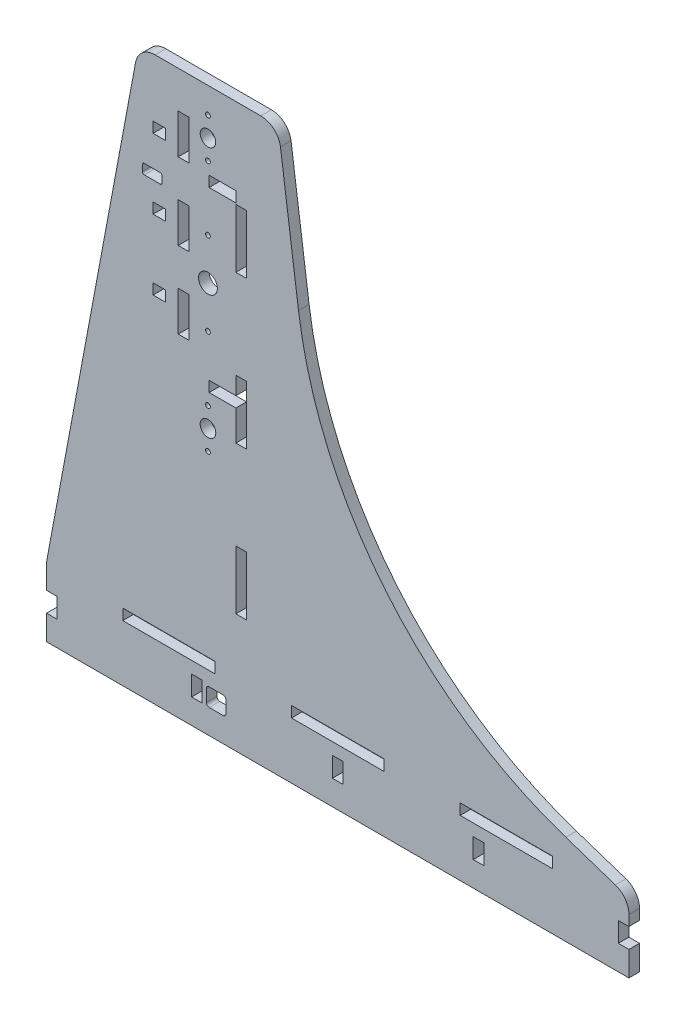
from build123d import *

# Parameters (mm, degrees)
MODEL_R             = 3.915
MODEL_R_2           = 1.2
MODEL_R_3           = 4.75
MODEL_R_4           = 3.95
MODEL_W             = 46.666
MODEL_H             = 5.5
MODEL_W_2           = 5.35
MODEL_H_2           = 10
MODEL_W_3           = 6.35
MODEL_H_3           = 5.35
MODEL_H_4           = 20
MODEL_H_5           = 29.666
MODEL_W_4           = 13.5
BOSS_EXTRUDE1_DEPTH = 5.35


with BuildPart() as part:
    # Model → Boss-Extrude1 (new body)
    with BuildSketch(Plane.XY):
        with BuildLine():
            Line((-147, 22.5), (-147, 33.91))
            ThreePointArc((-147, 33.91), (-146.957472748, 34.831268946), (-146.830252706, 35.744702086))
            Line((-146.830252706, 35.744702086), (-102.020252706, 275.834702086))
            ThreePointArc((-102.020252706, 275.834702086), (-98.579560984, 281.692432023), (-92.19, 284))
            Line((-92.19, 284), (-38.8, 284))
            ThreePointArc((-38.8, 284), (-32.222459634, 281.532327843), (-28.891161913, 275.347192548))
            Line((-28.891161913, 275.347192548), (-19.790761745, 208.412149045))
            ThreePointArc((-19.790761745, 208.412149045), (24.403039643, 107.726661994), (115.140729145, 45.619246274))
            Line((115.140729145, 45.619246274), (140.162263543, 37.27877618))
            ThreePointArc((140.162263543, 37.27877618), (145.112417501, 33.639047376), (147, 27.791938494))
            Line((147, 27.791938494), (147, 22.5))
            Line((147, 22.5), (141.65, 22.5))
            Line((141.65, 22.5), (141.65, 12.5))
            Line((141.65, 12.5), (147, 12.5))
            Line((147, 12.5), (147, 0))
            Line((147, 0), (-147, 0))
            Line((-147, 0), (-147, 12.5))
            Line((-147, 12.5), (-141.65, 12.5))
            Line((-141.65, 12.5), (-141.65, 22.5))
            Line((-141.65, 22.5), (-147, 22.5))
        make_face()
        with Locations((-65.5, 261)):
            Circle(MODEL_R, mode=Mode.SUBTRACT)
        with Locations((-65.5, 271)):
            Circle(MODEL_R_2, mode=Mode.SUBTRACT)
        with Locations((-65.5, 251)):
            Circle(MODEL_R_2, mode=Mode.SUBTRACT)
        with Locations((-65.5, 197.5)):
            Circle(MODEL_R_3, mode=Mode.SUBTRACT)
        with Locations((-65.5, 218.5)):
            Circle(MODEL_R_2, mode=Mode.SUBTRACT)
        with Locations((-65.5, 176.5)):
            Circle(MODEL_R_2, mode=Mode.SUBTRACT)
        with Locations((-65.5, 134.001)):
            Circle(MODEL_R_4, mode=Mode.SUBTRACT)
        with Locations((-65.5, 144.001)):
            Circle(MODEL_R_2, mode=Mode.SUBTRACT)
        with Locations((-65.5, 124.001)):
            Circle(MODEL_R_2, mode=Mode.SUBTRACT)
        with Locations((-0.001, 31.25)):
            Rectangle(MODEL_W, MODEL_H, mode=Mode.SUBTRACT)
        with Locations((-85.167, 31.25)):
            Rectangle(MODEL_W, MODEL_H, mode=Mode.SUBTRACT)
        with Locations((85.165, 31.25)):
            Rectangle(MODEL_W, MODEL_H, mode=Mode.SUBTRACT)
        with Locations((0.005, 17.5)):
            Rectangle(MODEL_W_2, MODEL_H_2, mode=Mode.SUBTRACT)
        with Locations((-71.075, 17.5)):
            Rectangle(MODEL_W_2, MODEL_H_2, mode=Mode.SUBTRACT)
        with Locations((71.085, 17.5)):
            Rectangle(MODEL_W_2, MODEL_H_2, mode=Mode.SUBTRACT)
        with Locations((-90.025, 216.5)):
            Rectangle(MODEL_W_3, MODEL_H_3, mode=Mode.SUBTRACT)
        with BuildLine():
            Line((-64.85, 21.33), (-57.85, 21.33))
            ThreePointArc((-57.85, 21.33), (-56.789339828, 20.890660172), (-56.35, 19.83))
            Line((-56.35, 19.83), (-56.35, 13.83))
            ThreePointArc((-56.35, 13.83), (-56.789339828, 12.769339828), (-57.85, 12.33))
            Line((-57.85, 12.33), (-64.85, 12.33))
            ThreePointArc((-64.85, 12.33), (-65.910660172, 12.769339828), (-66.35, 13.83))
            Line((-66.35, 13.83), (-66.35, 19.83))
            ThreePointArc((-66.35, 19.83), (-65.910660172, 20.890660172), (-64.85, 21.33))
        make_face(mode=Mode.SUBTRACT)
        with Locations((-90.025, 251.85)):
            Rectangle(MODEL_W_3, MODEL_H_3, mode=Mode.SUBTRACT)
        with Locations((-90.025, 181.15)):
            Rectangle(MODEL_W_3, MODEL_H_3, mode=Mode.SUBTRACT)
        with Locations((-77.825, 216.5)):
            Rectangle(MODEL_W_2, MODEL_H_4, mode=Mode.SUBTRACT)
        with Locations((-77.825, 255.25)):
            Rectangle(MODEL_W_2, MODEL_H_4, mode=Mode.SUBTRACT)
        with Locations((-77.825, 177.75)):
            Rectangle(MODEL_W_2, MODEL_H_4, mode=Mode.SUBTRACT)
        Polygon((-51.4, 164.334), (-46.05, 164.334), (-46.05, 134.668), (-51.4, 134.668), (-51.4, 150.001), (-64.9, 150.001), (-64.9, 155.351), (-51.4, 155.351), align=None, mode=Mode.SUBTRACT)
        with BuildLine():
            Line((-89.595, 228.801), (-97.595, 228.801))
            ThreePointArc((-97.595, 228.801), (-98.302106781, 229.093893219), (-98.595, 229.801))
            Line((-98.595, 229.801), (-98.595, 232.801))
            ThreePointArc((-98.595, 232.801), (-98.302106781, 233.508106781), (-97.595, 233.801))
            Line((-97.595, 233.801), (-89.595, 233.801))
            ThreePointArc((-89.595, 233.801), (-88.887893219, 233.508106781), (-88.595, 232.801))
            Line((-88.595, 232.801), (-88.595, 229.801))
            ThreePointArc((-88.595, 229.801), (-88.887893219, 229.093893219), (-89.595, 228.801))
        make_face(mode=Mode.SUBTRACT)
        with Locations((-48.725, 224.167)):
            Rectangle(MODEL_W_2, MODEL_H_5, mode=Mode.SUBTRACT)
        with Locations((-48.725, 74.835)):
            Rectangle(MODEL_W_2, MODEL_H_5, mode=Mode.SUBTRACT)
        with Locations((-58.15, 242.325)):
            Rectangle(MODEL_W_4, MODEL_H_3, mode=Mode.SUBTRACT)
    extrude(amount=BOSS_EXTRUDE1_DEPTH)


solid = part.part
